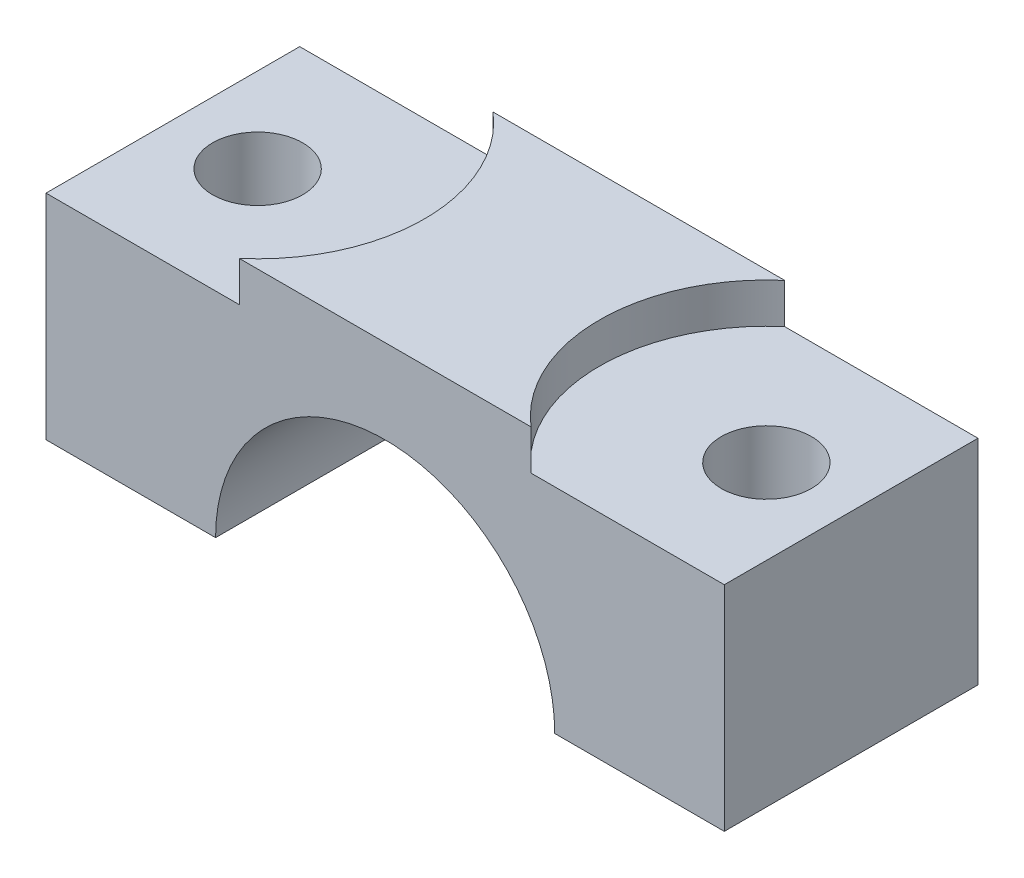
from build123d import *

# Parameters (mm, degrees)
BOSS_EXTRUDE1_DEPTH                           = 9.5
CBORE_FOR_M12_HEX_HEAD_CAP_SCREW1_D           = 6.75
CBORE_FOR_M12_HEX_HEAD_CAP_SCREW1_CBORE_D     = 25
CBORE_FOR_M12_HEX_HEAD_CAP_SCREW1_CBORE_DEPTH = 3


with BuildPart() as part:
    # Sketch2 → Boss-Extrude1 (new, symmetric)
    with BuildSketch(Plane.XY):
        with BuildLine():
            Line((12.7, 0), (25.4, 0))
            Line((25.4, 0), (25.4, 19))
            Line((25.4, 19), (-25.4, 19))
            Line((-25.4, 19), (-25.4, 0))
            Line((-25.4, 0), (-12.7, 0))
            ThreePointArc((-12.7, 0), (0, 12.7), (12.7, 0))
        make_face()
    extrude(amount=BOSS_EXTRUDE1_DEPTH, both=True)

    # CBORE for M12 Hex Head Cap Screw1 (through all)
    with Locations(Plane(origin=(0, 19, 0), x_dir=(1, 0, 0), z_dir=(0, 1, 0))):
        with Locations((-19.05, 0), (19.05, 0)):
            CounterBoreHole(CBORE_FOR_M12_HEX_HEAD_CAP_SCREW1_D / 2, CBORE_FOR_M12_HEX_HEAD_CAP_SCREW1_CBORE_D / 2, CBORE_FOR_M12_HEX_HEAD_CAP_SCREW1_CBORE_DEPTH)


solid = part.part
